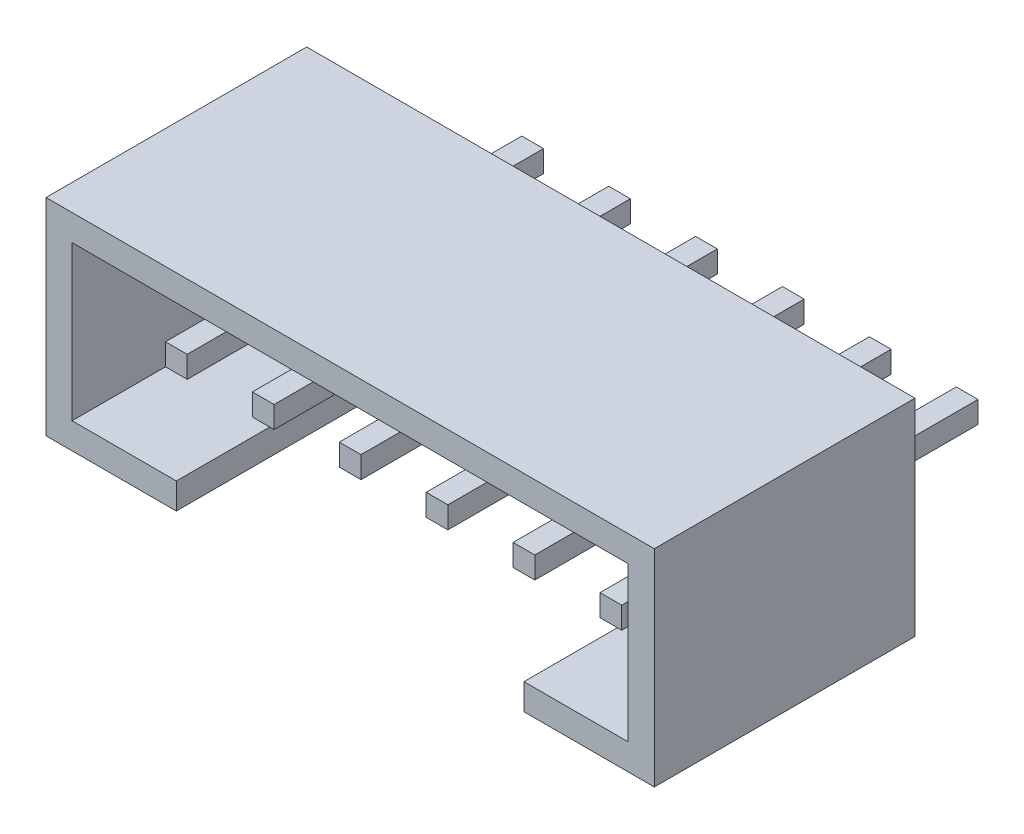
from build123d import *

# Parameters (mm, degrees)
SKETCH1_W           = 14
SKETCH1_H           = 4.75
BOSS_EXTRUDE1_DEPTH = 1.8
BOSS_EXTRUDE2_DEPTH = 4.2
BOSS_EXTRUDE3_START = -5
SKETCH3_W           = 0.5
SKETCH3_H           = 0.5
BOSS_EXTRUDE3_DEPTH = 8.2
LPATTERN1_COUNT     = 6
LPATTERN1_PITCH     = 2


with BuildPart() as part:
    # Sketch1 → Boss-Extrude1 (new body)
    with BuildSketch(Plane.XY):
        Rectangle(SKETCH1_W, SKETCH1_H)
    extrude(amount=BOSS_EXTRUDE1_DEPTH)

    # Sketch2 → Boss-Extrude2 (add)
    with BuildSketch(Plane.XY.offset(1.8)):
        Polygon((-4, -2.375), (-4, -1.775), (-6.4, -1.775), (-6.4, 1.775), (6.4, 1.775), (6.4, -1.775), (4, -1.775), (4, -2.375), (7, -2.375), (7, 2.375), (-7, 2.375), (-7, -2.375), align=None)
    extrude(amount=BOSS_EXTRUDE2_DEPTH)

    # Sketch3 → Boss-Extrude3 (add)
    with BuildSketch(Plane.XY.offset(1.8).offset(BOSS_EXTRUDE3_START)):
        with Locations((-5, -0.375)):
            Rectangle(SKETCH3_W, SKETCH3_H)
    boss_extrude3 = extrude(amount=BOSS_EXTRUDE3_DEPTH)

    # LPattern1: Boss-Extrude3 ×6
    with Locations(*[(i * LPATTERN1_PITCH, 0, 0) for i in range(1, LPATTERN1_COUNT)]):
        add(boss_extrude3)


solid = part.part
